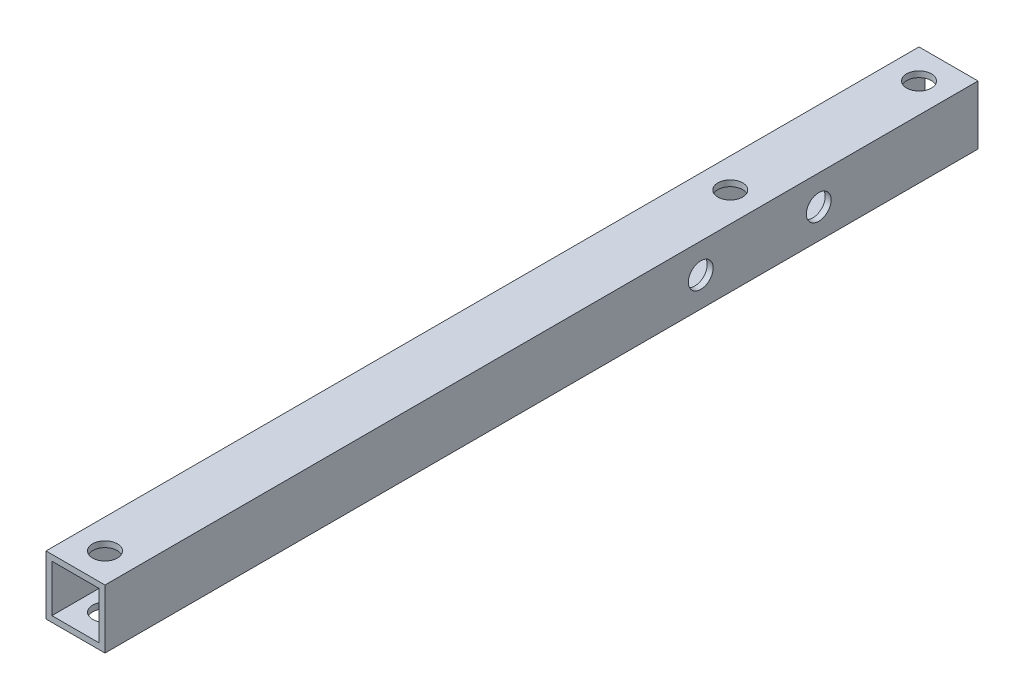
from build123d import *

# Parameters (mm, degrees)
SKETCH_1_W               = 10
SKETCH_1_H               = 10
SKETCH_1_W_2             = 8
SKETCH_1_H_2             = 8
EXTRUDE_1_DEPTH          = 148
CUT_EXTRUDE_1_DEPTH      = 149.67414032
CUT_EXTRUDE_1_DEPTH_BACK = 149.67414032
SKETCH_2_R               = 2.1
SKETCH_3_R               = 2.1
CUT_EXTRUDE_2_DEPTH      = 149.67414032


with BuildPart() as part:
    # 草图1 → 拉伸-薄壁1 (new body)
    with BuildSketch(Plane.XY):
        with Locations((5, -5)):
            Rectangle(SKETCH_1_W, SKETCH_1_H)
        with Locations((5, -5)):
            Rectangle(SKETCH_1_W_2, SKETCH_1_H_2, mode=Mode.SUBTRACT)
    extrude(amount=EXTRUDE_1_DEPTH)

    # 草图2 → 切除-拉伸1 (cut, two sides: drawn at the far end of the back side and taken through both)
    with BuildSketch(Plane.ZY.offset(-CUT_EXTRUDE_1_DEPTH_BACK)):
        with Locations(Location((27, -5, 0), (0, 0, 270))):
            Circle(SKETCH_2_R)
        with Locations(Location((47, -5, 0), (0, 0, 270))):
            Circle(SKETCH_2_R)
    extrude(amount=CUT_EXTRUDE_1_DEPTH + CUT_EXTRUDE_1_DEPTH_BACK, mode=Mode.SUBTRACT)

    # 草图3 → 切除-拉伸2 (cut, through all)
    with BuildSketch(Plane(origin=(0, 0, 0), x_dir=(1, 0, 0), z_dir=(0, 1, 0))):
        with Locations(Location((5, -5, 0), (0, 0, 270))):
            Circle(SKETCH_3_R)
        with Locations(Location((5, -143, 0), (0, 0, 90))):
            Circle(SKETCH_3_R)
        with Locations(Location((5, -37, 0), (0, 0, 270))):
            Circle(SKETCH_3_R)
    extrude(amount=-CUT_EXTRUDE_2_DEPTH, mode=Mode.SUBTRACT)


solid = part.part
